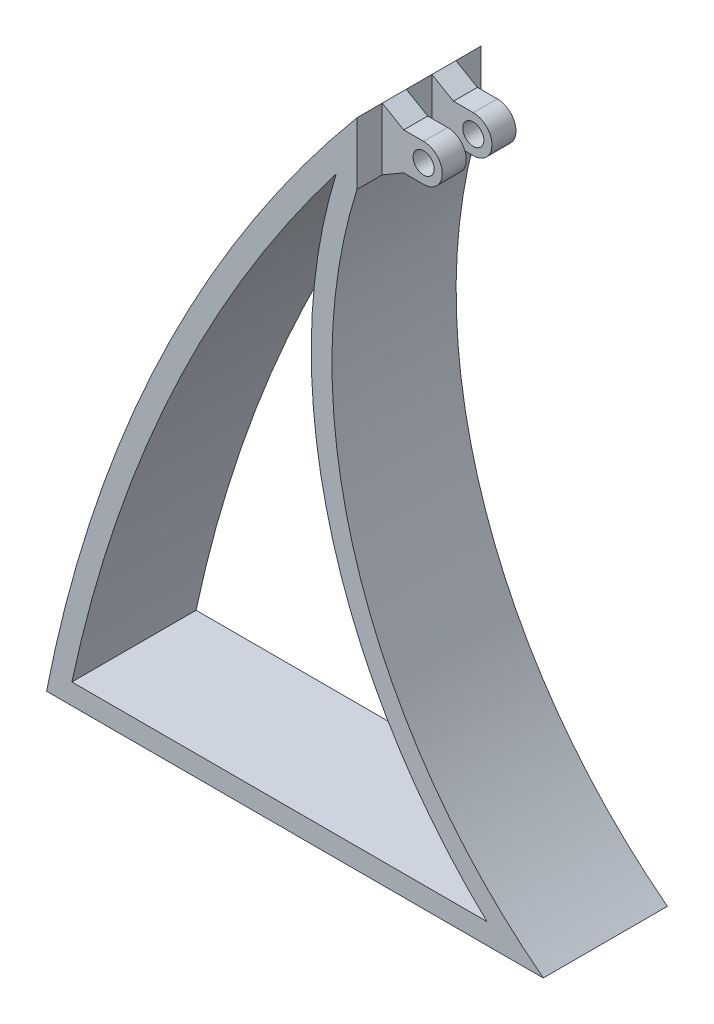
from build123d import *

# Parameters (mm, degrees)
BOSS_EXTRUDE1_DEPTH = 15
CUT_EXTRUDE1_DEPTH  = 172.190683158
BOSS_EXTRUDE2_START = 3.1
SKETCH4_R           = 2.55
BOSS_EXTRUDE2_DEPTH = 5.8


with BuildPart() as part:
    # Sketch1 → Boss-Extrude1 (new, symmetric)
    with BuildSketch(Plane.XY):
        with BuildLine():
            Line((-60, 0), (60, 0))
            ThreePointArc((60, 0), (14.978542663, 64.137960841), (15, 142.5))
            Line((15, 142.5), (15, 157.5))
            ThreePointArc((15, 157.5), (-32.469836355, 83.497541122), (-60, 0))
        make_face()
    extrude(amount=BOSS_EXTRUDE1_DEPTH, both=True)

    # Sketch3 → Cut-Extrude1 (cut, through all)
    with BuildSketch(Plane.XY.offset(15)):
        with BuildLine():
            Line((10, 143.26466224), (10, 143.272073771))
            ThreePointArc((10, 143.272073771), (-29.664180918, 77.705142353), (-53.876409624, 5))
            Line((-53.876409624, 5), (46.39672745, 5))
            ThreePointArc((46.39672745, 5), (8.391850624, 68.918473527), (10, 143.26466224))
        make_face()
    extrude(amount=-CUT_EXTRUDE1_DEPTH, mode=Mode.SUBTRACT)

    # Sketch4 → Boss-Extrude2 (add)
    with BuildSketch(Plane.XY.offset(BOSS_EXTRUDE2_START)):
        with BuildLine():
            Line((25, 145.5), (20.196152423, 145.5))
            Line((20.196152423, 145.5), (15, 142.5))
            Line((15, 142.5), (15, 157.5))
            Line((15, 157.5), (20.196152423, 154.5))
            Line((20.196152423, 154.5), (25, 154.5))
            ThreePointArc((25, 154.5), (29.5, 150), (25, 145.5))
        make_face()
        with Locations((25, 150)):
            Circle(SKETCH4_R, mode=Mode.SUBTRACT)
    boss_extrude2 = extrude(amount=BOSS_EXTRUDE2_DEPTH)

    # Mirror1: Boss-Extrude2 across plane
    add(boss_extrude2.mirror(Plane.XY))


solid = part.part
